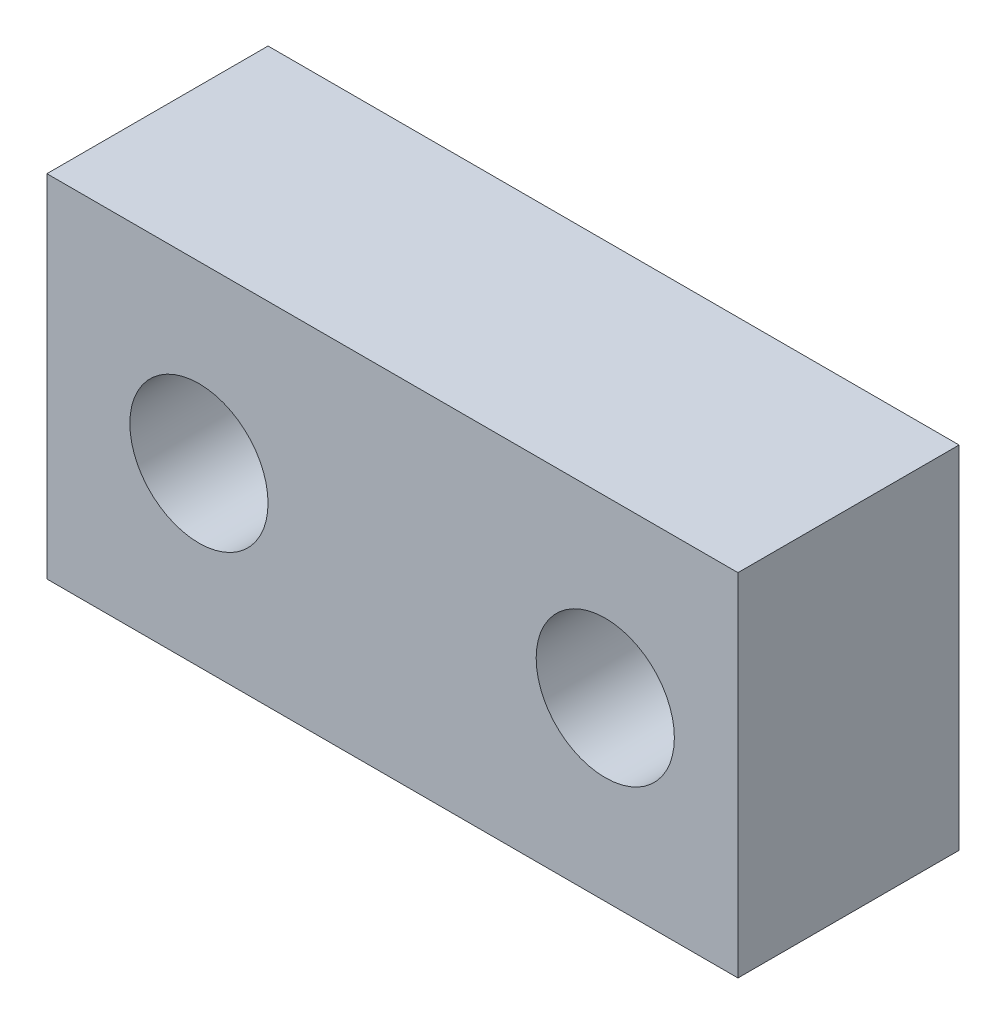
from build123d import *

# Parameters (mm, degrees)
ESQUISSE1_W             = 25
ESQUISSE1_H             = 12.7
BOSS_EXTRU_1_DEPTH      = 8
ESQUISSE2_R             = 2.5
ENL_V_MAT_EXTRU_1_DEPTH = 10


with BuildPart() as part:
    # Esquisse1 → Boss.-Extru.1 (new body)
    with BuildSketch(Plane.XY):
        Rectangle(ESQUISSE1_W, ESQUISSE1_H)
    extrude(amount=BOSS_EXTRU_1_DEPTH)

    # Esquisse2 → Enlèv. mat.-Extru.1 (cut)
    with BuildSketch(Plane(origin=(0, 0, 0), x_dir=(-1, 0, 0), z_dir=(0, 0, -1))):
        with Locations((-7.7, 0.025)):
            Circle(ESQUISSE2_R)
        with Locations((7, 0.025)):
            Circle(ESQUISSE2_R)
    extrude(amount=-ENL_V_MAT_EXTRU_1_DEPTH, mode=Mode.SUBTRACT)


solid = part.part
